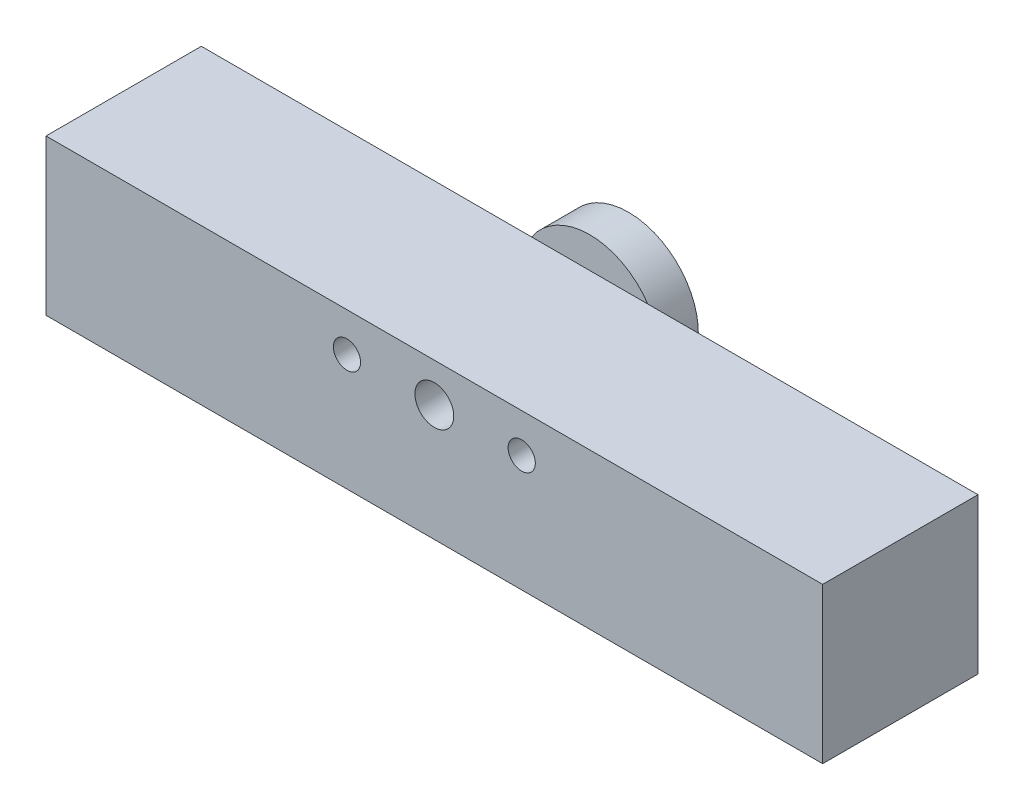
from build123d import *

# Parameters (mm, degrees)
SKETCH2_W           = 200
SKETCH2_H           = 40
BOSS_EXTRUDE1_DEPTH = 40
SKETCH3_R           = 18
BOSS_EXTRUDE2_DEPTH = 10
SKETCH4_R           = 5
CUT_EXTRUDE1_DEPTH  = 51
SKETCH5_R           = 3.5
CUT_EXTRUDE2_DEPTH  = 51


with BuildPart() as part:
    # Sketch2 → Boss-Extrude1 (new body)
    with BuildSketch(Plane(origin=(0, 0, 0), x_dir=(1, 0, 0), z_dir=(0, 1, 0))):
        with Locations((100, 20)):
            Rectangle(SKETCH2_W, SKETCH2_H)
    extrude(amount=BOSS_EXTRUDE1_DEPTH)

    # Sketch3 → Boss-Extrude2 (add)
    with BuildSketch(Plane(origin=(0, 0, -40), x_dir=(-1, 0, 0), z_dir=(0, 0, -1))):
        with Locations(Location((-100, 30, 0), (0, 0, 146.251011404))):
            Circle(SKETCH3_R)
    extrude(amount=BOSS_EXTRUDE2_DEPTH)

    # Sketch4 → Cut-Extrude1 (cut)
    with BuildSketch(Plane(origin=(0, 0, -50), x_dir=(-1, 0, 0), z_dir=(0, 0, -1))):
        with Locations((-100, 30)):
            Circle(SKETCH4_R)
    extrude(amount=-CUT_EXTRUDE1_DEPTH, mode=Mode.SUBTRACT)

    # Sketch5 → Cut-Extrude2 (cut)
    with BuildSketch(Plane(origin=(0, 0, -50), x_dir=(-1, 0, 0), z_dir=(0, 0, -1))):
        with Locations((-77.5, 30)):
            Circle(SKETCH5_R)
        with Locations((-122.5, 30)):
            Circle(SKETCH5_R)
    extrude(amount=-CUT_EXTRUDE2_DEPTH, mode=Mode.SUBTRACT)


solid = part.part
